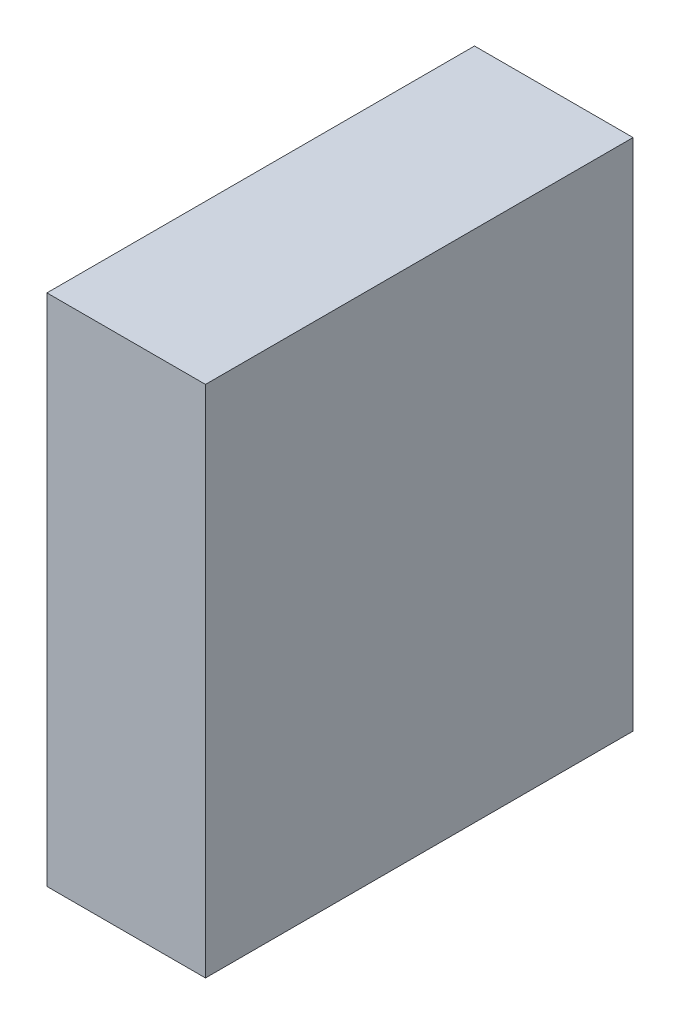
from build123d import *

# Parameters (mm, degrees)
SKETCH1_W           = 33
SKETCH1_H           = 107
BOSS_EXTRUDE1_DEPTH = 89


with BuildPart() as part:
    # Sketch1 → Boss-Extrude1 (new body)
    with BuildSketch(Plane.XY):
        Rectangle(SKETCH1_W, SKETCH1_H)
    extrude(amount=BOSS_EXTRUDE1_DEPTH)


solid = part.part
